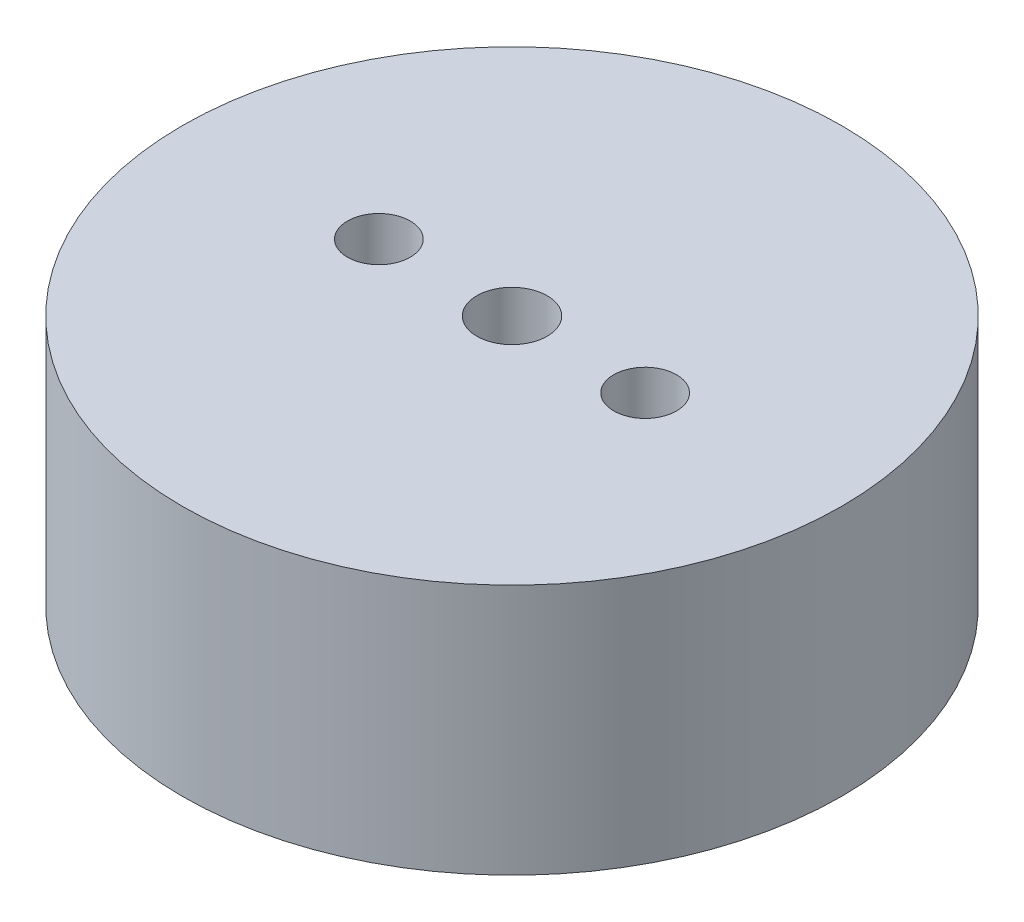
from build123d import *

# Parameters (mm, degrees)
SKETCH1_R           = 33.3375
BOSS_EXTRUDE1_DEPTH = 25.4
SKETCH2_R           = 3.556
CUT_EXTRUDE1_DEPTH  = 54.553130744
SKETCH3_R           = 3.175
CUT_EXTRUDE2_DEPTH  = 54.553130744


with BuildPart() as part:
    # Sketch1 → Boss-Extrude1 (new body)
    with BuildSketch(Plane(origin=(0, 0, 0), x_dir=(1, 0, 0), z_dir=(0, 1, 0))):
        with Locations(Location((0, 0, 0), (0, 0, 270))):
            Circle(SKETCH1_R)
    extrude(amount=BOSS_EXTRUDE1_DEPTH)

    # Sketch2 → Cut-Extrude1 (cut, through all)
    with BuildSketch(Plane(origin=(0, 25.4, 0), x_dir=(1, 0, 0), z_dir=(0, 1, 0))):
        with Locations(Location((0, 0, 0), (0, 0, 270))):
            Circle(SKETCH2_R)
    extrude(amount=-CUT_EXTRUDE1_DEPTH, mode=Mode.SUBTRACT)

    # Sketch3 → Cut-Extrude2 (cut, through all)
    with BuildSketch(Plane(origin=(0, 25.4, 0), x_dir=(-1, 0, 0), z_dir=(0, 1, 0))):
        with Locations(Location((13.462, 0, 0), (0, 0, 90))):
            Circle(SKETCH3_R)
        with Locations(Location((-13.462, 0, 0), (0, 0, 270))):
            Circle(SKETCH3_R)
    extrude(amount=-CUT_EXTRUDE2_DEPTH, mode=Mode.SUBTRACT)


solid = part.part
